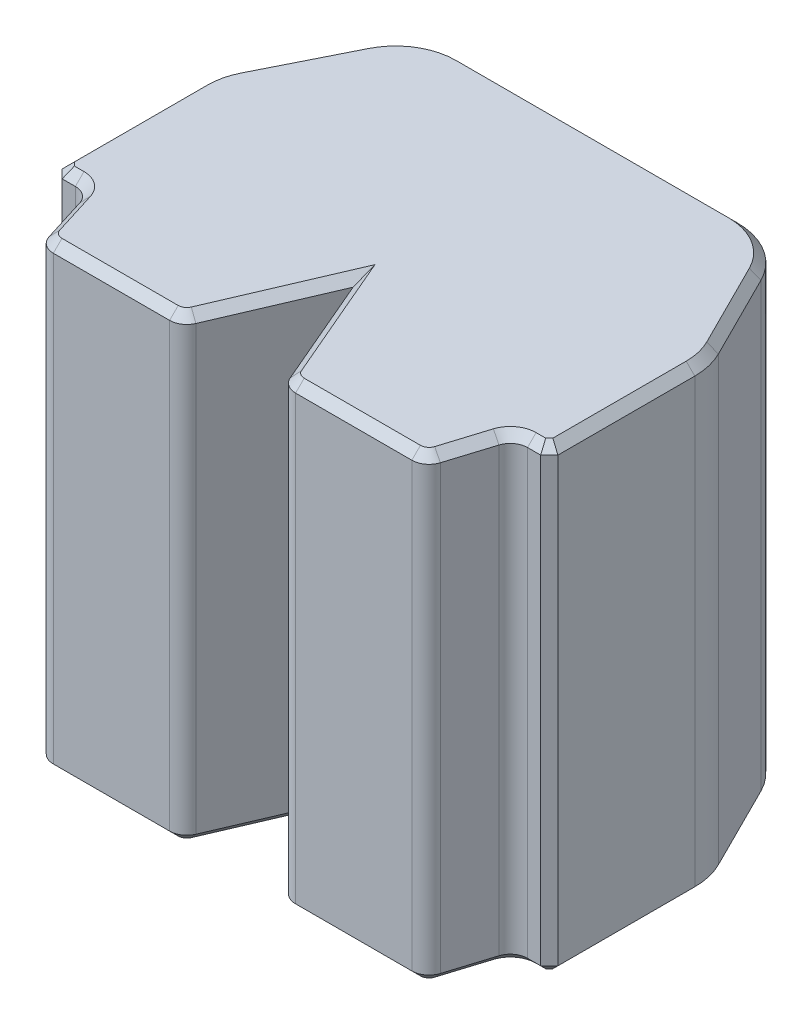
from build123d import *

# Parameters (mm, degrees)
BOSS_EXTRUDE1_DEPTH = 26.7
FILLET1_R           = 4
FILLET2_R           = 1
CHAMFER1_SIZE       = 0.5
CHAMFER2_SIZE       = 0.5
SKETCH2_R           = 2
CUT_EXTRUDE1_DEPTH  = 12


with BuildPart() as part:
    # Sketch1 → Boss-Extrude1 (new body)
    with BuildSketch(Plane(origin=(0, 0, 0), x_dir=(1, 0, 0), z_dir=(0, 1, 0))):
        Polygon((10.4, 10.7), (-10.4, 10.7), (-14.4, 2.7), (-14.4, -6.7), (-12.4, -6.7), (-11.15, -10.7), (-3, -10.7), (0, -3.7), (3, -10.7), (11.15, -10.7), (12.4, -6.7), (14.4, -6.7), (14.4, 2.7), align=None)
    extrude(amount=BOSS_EXTRUDE1_DEPTH)

    # Fillet1
    fillet1_edges = [part.edges().sort_by_distance(p)[0] for p in [
        (-14.4, 13.35, -2.7),
        (-10.4, 13.35, -10.7),
        (10.4, 13.35, -10.7),
        (14.4, 13.35, -2.7),
    ]]
    fillet(fillet1_edges, radius=FILLET1_R)

    # Fillet2
    fillet2_edges = [part.edges().sort_by_distance(p)[0] for p in [
        (-3, 13.35, 10.7),
        (-11.15, 13.35, 10.7),
        (-12.4, 13.35, 6.7),
        (12.4, 13.35, 6.7),
        (11.15, 13.35, 10.7),
        (3, 13.35, 10.7),
    ]]
    fillet(fillet2_edges, radius=FILLET2_R)

    # Chamfer1
    chamfer1_edges = [part.edges().sort_by_distance(p)[0] for p in [
        (-14.4, 13.35, 6.7),
        (14.4, 13.35, 6.7),
    ]]
    chamfer(chamfer1_edges, length=CHAMFER1_SIZE)

    # Chamfer2
    chamfer2_edges = [part.edges().sort_by_distance(p)[0] for p in [
        (-13.517595457, 0, 6.7),
        (-13.517595457, 26.7, 6.7),
        (-14.4, 0, 2.222135955),
        (1.370125564, 26.7, 6.896959649),
        (14.4, 0, 2.222135955),
        (13.517595457, 0, 6.7),
        (14.15, 0, 6.45),
        (-14.15, 0, 6.45),
        (-14.4, 26.7, 2.222135955),
        (13.517595457, 26.7, 6.7),
        (14.4, 26.7, 2.222135955),
        (14.15, 26.7, 6.45),
        (-14.15, 26.7, 6.45),
        (1.370125564, 0, 6.896959649),
        (-12.741640786, 0, -6.016718427),
        (0, 0, -10.7),
        (12.741640786, 0, -6.016718427),
        (-10.030788493, 0, -10.102603233),
        (10.030788493, 0, -10.102603233),
        (14.292995958, 0, -2.674739772),
        (-14.292995958, 0, -2.674739772),
        (-12.741640786, 26.7, -6.016718427),
        (12.741640786, 26.7, -6.016718427),
        (0, 26.7, -10.7),
        (-10.030788493, 26.7, -10.102603233),
        (10.030788493, 26.7, -10.102603233),
        (14.292995958, 26.7, -2.674739772),
        (-14.292995958, 26.7, -2.674739772),
        (-1.370125564, 0, 6.896959649),
        (-1.370125564, 26.7, 6.896959649),
        (11.775, 0, 8.7),
        (7.037102622, 0, 10.7),
        (-7.037102622, 0, 10.7),
        (-11.775, 0, 8.7),
        (-11.007145565, 0, 10.505690695),
        (11.007145565, 0, 10.505690695),
        (3.108905149, 0, 10.534841092),
        (-3.108905149, 0, 10.534841092),
        (-7.037102622, 26.7, 10.7),
        (-11.775, 26.7, 8.7),
        (7.037102622, 26.7, 10.7),
        (11.775, 26.7, 8.7),
        (-11.007145565, 26.7, 10.505690695),
        (11.007145565, 26.7, 10.505690695),
        (3.108905149, 26.7, 10.534841092),
        (-3.108905149, 26.7, 10.534841092),
        (12.542854435, 0, 6.894309305),
        (12.542854435, 26.7, 6.894309305),
        (-12.542854435, 0, 6.894309305),
        (-12.542854435, 26.7, 6.894309305),
    ]]
    chamfer(chamfer2_edges, length=CHAMFER2_SIZE)

    # Sketch2 → Cut-Extrude1 (cut)
    with BuildSketch(Plane(origin=(0, 0, -10.7), x_dir=(-1, 0, 0), z_dir=(0, 0, -1))):
        with Locations((-4, 22.15)):
            Circle(SKETCH2_R)
        with Locations((4, 22.15)):
            Circle(SKETCH2_R)
        with Locations((-4, 17.75)):
            Circle(SKETCH2_R)
        with Locations((4, 17.75)):
            Circle(SKETCH2_R)
        with Locations((-4, 13.35)):
            Circle(SKETCH2_R)
        with Locations((4, 13.35)):
            Circle(SKETCH2_R)
        with Locations((-4, 8.95)):
            Circle(SKETCH2_R)
        with Locations((4, 8.95)):
            Circle(SKETCH2_R)
        with Locations((-4, 4.55)):
            Circle(SKETCH2_R)
        with Locations((4, 4.55)):
            Circle(SKETCH2_R)
    extrude(amount=-CUT_EXTRUDE1_DEPTH, mode=Mode.SUBTRACT)


solid = part.part
